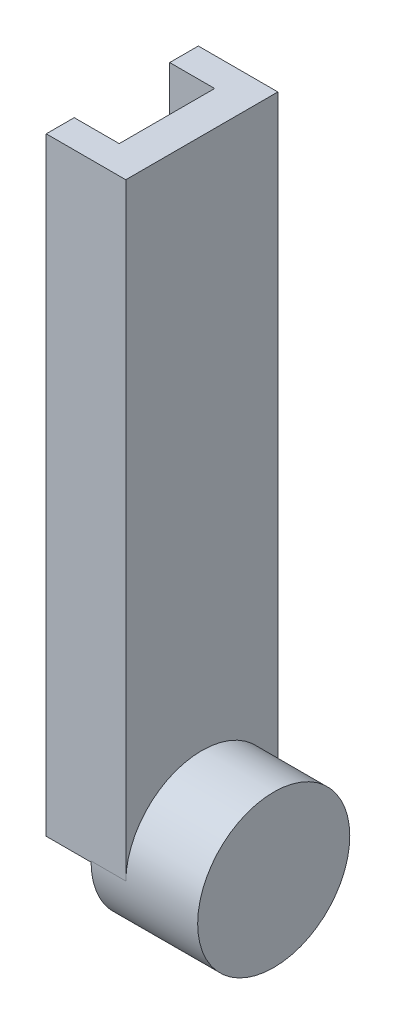
from build123d import *

# Parameters (mm, degrees)
SKETCH1_R           = 10
BOSS_EXTRUDE7_DEPTH = 14
SKETCH7_W           = 10.45925955
SKETCH7_H           = 19.99905213
BOSS_EXTRUDE9_DEPTH = 80
SKETCH8_W           = 5.913333595
SKETCH8_H           = 12.55111146
CUT_EXTRUDE3_DEPTH  = 55


with BuildPart() as part:
    # Sketch1 → Boss-Extrude7 (new body)
    with BuildSketch(Plane(origin=(0, 0, 0), x_dir=(0, 0, -1), z_dir=(1, 0, 0))):
        Circle(SKETCH1_R)
    extrude(amount=BOSS_EXTRUDE7_DEPTH)

    # Sketch7 → Boss-Extrude9 (add)
    with BuildSketch(Plane(origin=(0, 0, 0), x_dir=(1, 0, 0), z_dir=(0, 1, 0))):
        with Locations((-0.68370382, 0.000473935)):
            Rectangle(SKETCH7_W, SKETCH7_H)
    extrude(amount=BOSS_EXTRUDE9_DEPTH)

    # Sketch8 → Cut-Extrude3 (cut)
    with BuildSketch(Plane(origin=(0, 80, 0), x_dir=(1, 0, 0), z_dir=(0, 1, 0))):
        with Locations((-2.956666798, -0.041837038)):
            Rectangle(SKETCH8_W, SKETCH8_H)
    extrude(amount=-CUT_EXTRUDE3_DEPTH, mode=Mode.SUBTRACT)


solid = part.part
